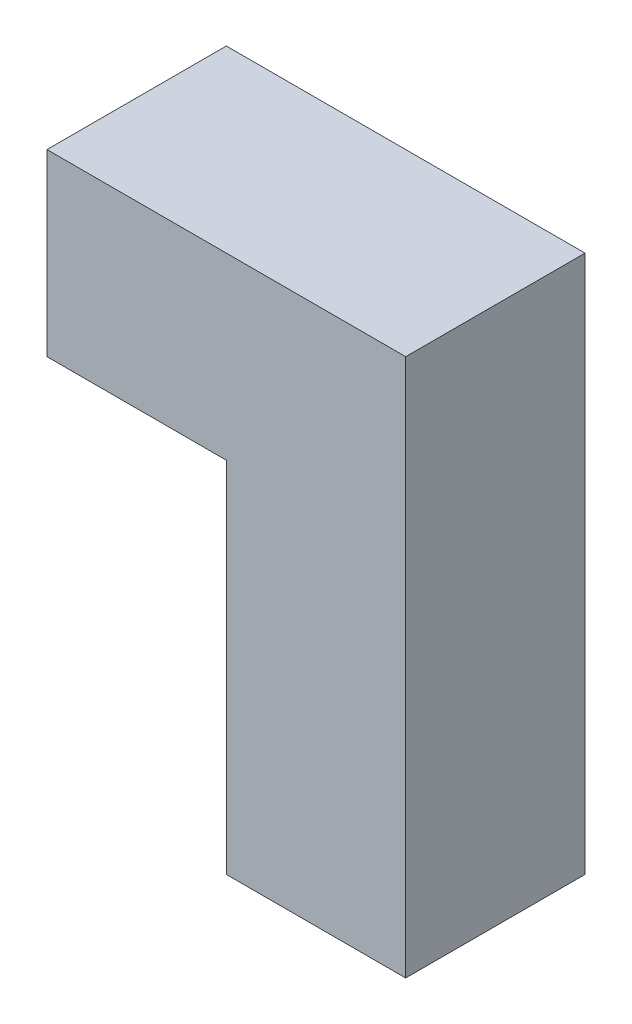
from build123d import *

# Parameters (mm, degrees)
SKETCH1_W           = 90
SKETCH1_H           = 60
BOSS_EXTRUDE1_DEPTH = 15
CUT_EXTRUDE1_DEPTH  = 62.846584384


with BuildPart() as part:
    # Sketch1 → Boss-Extrude1 (new, symmetric)
    with BuildSketch(Plane(origin=(0, 0, 0), x_dir=(0, 1, 0), z_dir=(0, 0, 1))):
        Rectangle(SKETCH1_W, SKETCH1_H)
    extrude(amount=BOSS_EXTRUDE1_DEPTH, both=True)

    # Sketch2 → Cut-Extrude1 (cut, through all)
    with BuildSketch(Plane.XY.offset(15)):
        Polygon((0, -15), (0, 15), (-30, 15), (-30, -45), (0, -45), align=None)
    extrude(amount=-CUT_EXTRUDE1_DEPTH, mode=Mode.SUBTRACT)


solid = part.part
